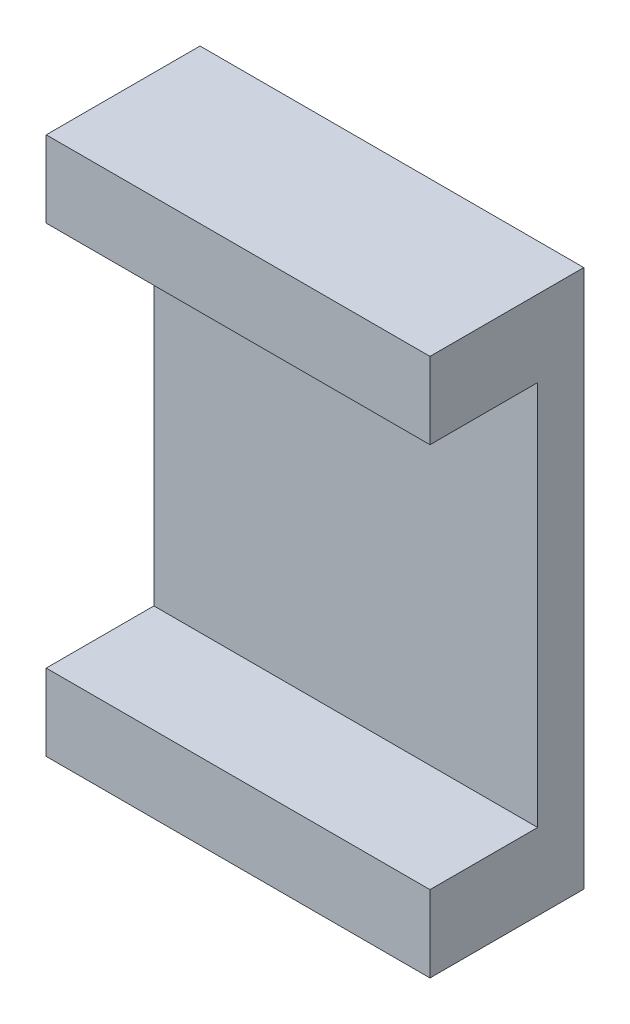
from build123d import *

# Parameters (mm, degrees)
SKETCH1_W           = 24.95
SKETCH1_H           = 35
BOSS_EXTRUDE1_DEPTH = 10
SKETCH2_W           = 24.95
SKETCH2_H           = 25.05
CUT_EXTRUDE1_DEPTH  = 7


with BuildPart() as part:
    # Sketch1 → Boss-Extrude1 (new body)
    with BuildSketch(Plane.XY):
        Rectangle(SKETCH1_W, SKETCH1_H)
    extrude(amount=BOSS_EXTRUDE1_DEPTH)

    # Sketch2 → Cut-Extrude1 (cut)
    with BuildSketch(Plane.XY.offset(10)):
        Rectangle(SKETCH2_W, SKETCH2_H)
    extrude(amount=-CUT_EXTRUDE1_DEPTH, mode=Mode.SUBTRACT)


solid = part.part
